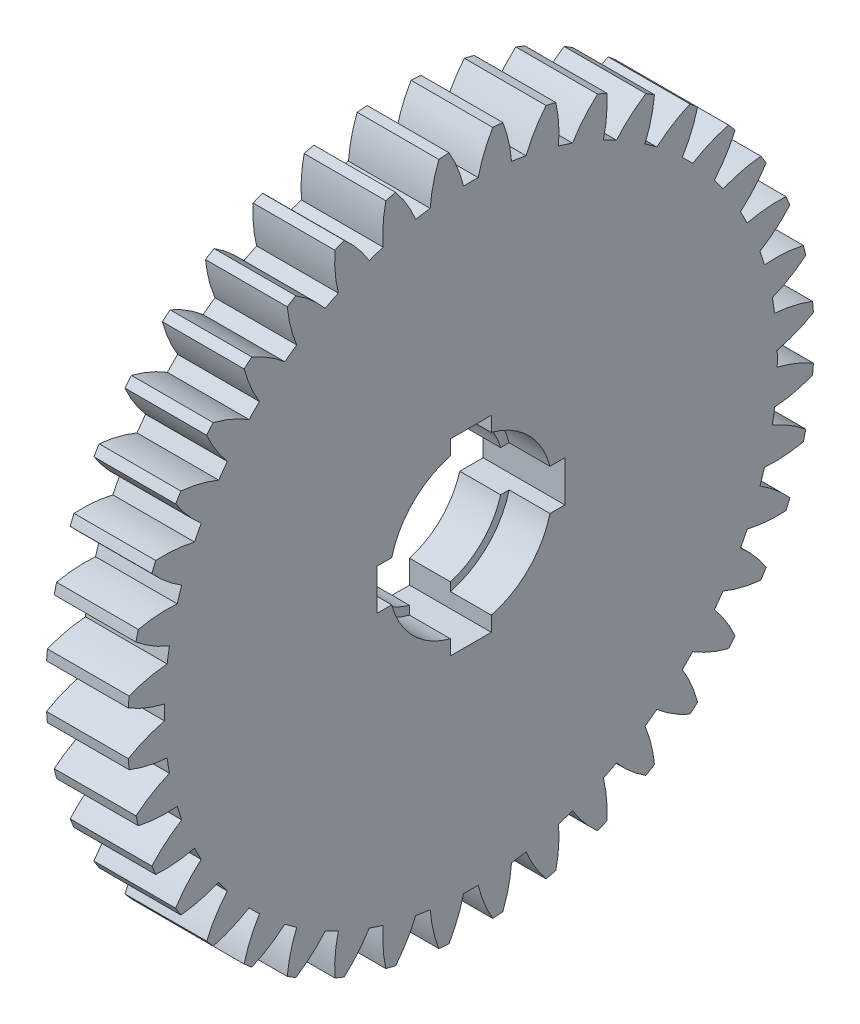
from build123d import *

# Parameters (mm, degrees)
BASPROSKE_W        = 8
BASPROSKE_H        = 21
TOOTHCUT_DEPTH     = 31.757112998
TEETHCUTS_COUNT    = 40
BORSKE_R           = 2.5
BORE_DEPTH         = 50.0000508
SKETCH1_R          = 30.395157115
CUT_EXTRUDE1_DEPTH = 3
CUT_EXTRUDE2_DEPTH = 31.056738792
SKETCH3_R          = 4.5
CUT_EXTRUDE3_DEPTH = 10
SKETCH4_R          = 5
CUT_EXTRUDE4_DEPTH = 2.5


with BuildPart() as part:
    # BasProSke → Base-Revolve (revolve)
    with BuildSketch(Plane(origin=(0, 0, 0), x_dir=(1, 0, 0), z_dir=(0, 1, 0)), mode=Mode.PRIVATE) as base_revolve_sk:
        with Locations((4, 10.5)):
            Rectangle(BASPROSKE_W, BASPROSKE_H)
    revolve(base_revolve_sk.sketch.rotate(Axis((-10, 0, 0), (1, 0, 0)), 180), axis=Axis((-10, 0, 0), (1, 0, 0)))

    # TooCutSke → ToothCut (cut, through all)
    with BuildSketch(Plane(origin=(0, 0, 0), x_dir=(0, 0, -1), z_dir=(1, 0, 0))):
        with BuildLine():
            ThreePointArc((0.448673268, 18.74363074), (0, 18.749), (-0.448673268, 18.74363074))
            ThreePointArc((-0.448673268, 18.74363074), (-0.816786816, 19.89705013), (-1.354745081, 20.981708961))
            ThreePointArc((-1.354745081, 20.981708961), (0, 21.0254), (1.354745081, 20.981708961))
            ThreePointArc((1.354745081, 20.981708961), (0.816786816, 19.89705013), (0.448673268, 18.74363074))
        make_face()
    toothcut = extrude(amount=TOOTHCUT_DEPTH, mode=Mode.SUBTRACT)

    # TeethCuts: ToothCut ×40 about axis
    teethcuts_axis = Axis((0, 0, 0), (1, 0, 0))
    for i in range(1, TEETHCUTS_COUNT):
        add(toothcut.rotate(teethcuts_axis, i * 360 / TEETHCUTS_COUNT), mode=Mode.SUBTRACT)

    # BorSke → Bore (cut, symmetric)
    with BuildSketch(Plane(origin=(0, 0, 0), x_dir=(0, 0, -1), z_dir=(1, 0, 0))):
        with Locations(Location((0, 0, 0), (0, 0, 180))):
            Circle(BORSKE_R)
    extrude(amount=BORE_DEPTH, both=True, mode=Mode.SUBTRACT)

    # Sketch1 → Cut-Extrude1 (cut)
    with BuildSketch(Plane(origin=(8, 0, 0), x_dir=(0, 0, -1), z_dir=(1, 0, 0))):
        with Locations((-0.364084054, 0)):
            Circle(SKETCH1_R)
    extrude(amount=-CUT_EXTRUDE1_DEPTH, mode=Mode.SUBTRACT)

    # Sketch2 → Cut-Extrude2 (cut, through all)
    with BuildSketch(Plane(origin=(5, 0, 0), x_dir=(0, 0, -1), z_dir=(1, 0, 0))):
        with BuildLine():
            Line((-1.25, 5.75), (1.25, 5.75))
            Line((1.25, 5.75), (1.25, 4.236088342))
            ThreePointArc((1.25, 4.236088342), (3.12305495, 3.12305495), (4.236088342, 1.25))
            Line((4.236088342, 1.25), (5.75, 1.25))
            Line((5.75, 1.25), (5.75, -1.25))
            Line((5.75, -1.25), (4.236088342, -1.25))
            ThreePointArc((4.236088342, -1.25), (3.12305495, -3.12305495), (1.25, -4.236088342))
            Line((1.25, -4.236088342), (1.25, -5.75))
            Line((1.25, -5.75), (-1.25, -5.75))
            Line((-1.25, -5.75), (-1.25, -4.236088342))
            ThreePointArc((-1.25, -4.236088342), (-3.12305495, -3.12305495), (-4.236088342, -1.25))
            Line((-4.236088342, -1.25), (-5.75, -1.25))
            Line((-5.75, -1.25), (-5.75, 1.25))
            Line((-5.75, 1.25), (-4.236088342, 1.25))
            ThreePointArc((-4.236088342, 1.25), (-3.12305495, 3.12305495), (-1.25, 4.236088342))
            Line((-1.25, 4.236088342), (-1.25, 5.75))
        make_face()
    extrude(amount=-CUT_EXTRUDE2_DEPTH, mode=Mode.SUBTRACT)

    # Sketch3 → Cut-Extrude3 (cut)
    with BuildSketch(Plane(origin=(5, 0, 0), x_dir=(0, 0, -1), z_dir=(1, 0, 0))):
        Circle(SKETCH3_R)
    extrude(amount=-CUT_EXTRUDE3_DEPTH, mode=Mode.SUBTRACT)

    # Sketch4 → Cut-Extrude4 (cut)
    with BuildSketch(Plane(origin=(5, 0, 0), x_dir=(0, 0, -1), z_dir=(1, 0, 0))):
        Circle(SKETCH4_R)
    extrude(amount=-CUT_EXTRUDE4_DEPTH, mode=Mode.SUBTRACT)


solid = part.part
